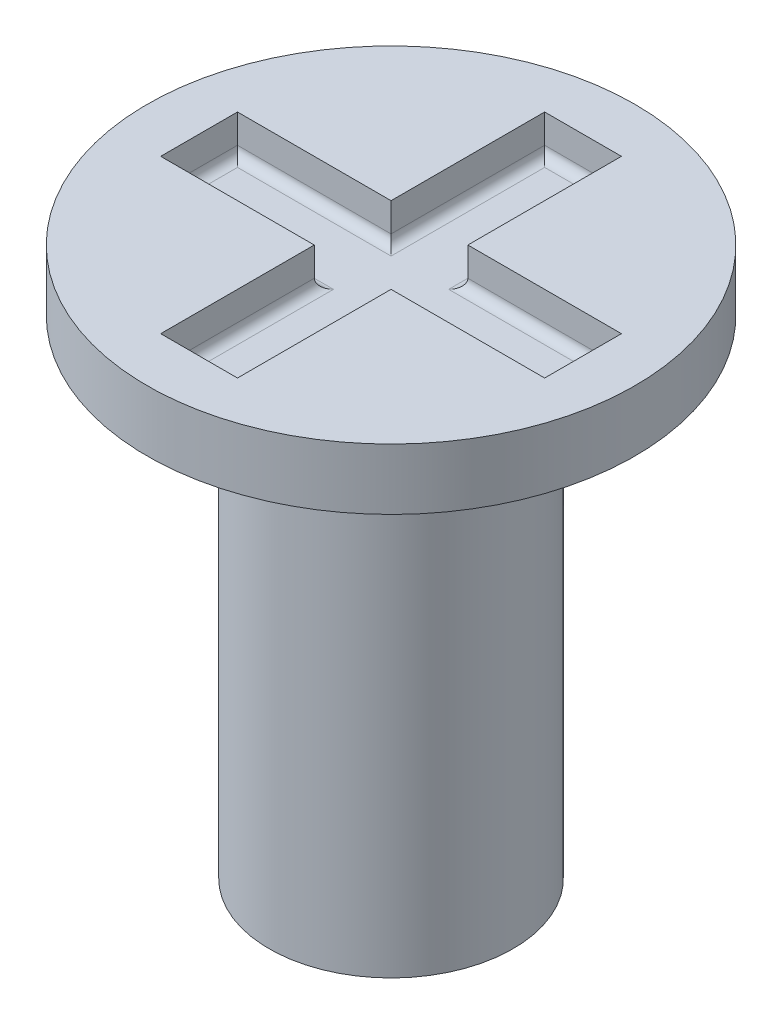
from build123d import *

# Parameters (mm, degrees)
SKETCH2_W               = 5
SKETCH2_H               = 1
SKETCH2_W_2             = 1
SKETCH2_H_2             = 5
CUT_EXTRUDE_THIN1_DEPTH = 0.5
FILLET2_R               = 0.125


with BuildPart() as part:
    # Sketch1 → Revolve1 (revolve)
    with BuildSketch(Plane.XY, mode=Mode.PRIVATE) as revolve1_sk:
        Polygon((0, 0), (0, -0.79375), (1.5875, -0.79375), (1.5875, -7.14375), (3.175, -7.14375), (3.175, 0), align=None)
    revolve(revolve1_sk.sketch.rotate(Axis((3.175, -7.14375, 0), (0, 1, 0)), 270), axis=Axis((3.175, -7.14375, 0), (0, 1, 0)))

    # Sketch2 → Cut-Extrude-Thin1 (cut)
    with BuildSketch(Plane(origin=(0, 0, 0), x_dir=(1, 0, 0), z_dir=(0, 1, 0))):
        with Locations((3.175, 0)):
            Rectangle(SKETCH2_W, SKETCH2_H)
        with Locations((3.175, 0)):
            Rectangle(SKETCH2_W_2, SKETCH2_H_2)
    extrude(amount=-CUT_EXTRUDE_THIN1_DEPTH, mode=Mode.SUBTRACT)

    # Fillet2
    fillet2_edges = [part.edges().sort_by_distance(p)[0] for p in [
        (4.675, -0.5, 0.5),
        (1.675, -0.5, 0.5),
        (1.675, -0.5, -0.5),
        (3.175, -0.5, -2.5),
        (3.675, -0.5, -1.5),
        (4.675, -0.5, -0.5),
        (5.675, -0.5, 0),
        (3.675, -0.5, 1.5),
        (3.175, -0.5, 2.5),
        (0.675, -0.5, 0),
        (2.675, -0.5, -1.5),
        (2.675, -0.5, 1.5),
    ]]
    fillet(fillet2_edges, radius=FILLET2_R)


solid = part.part
